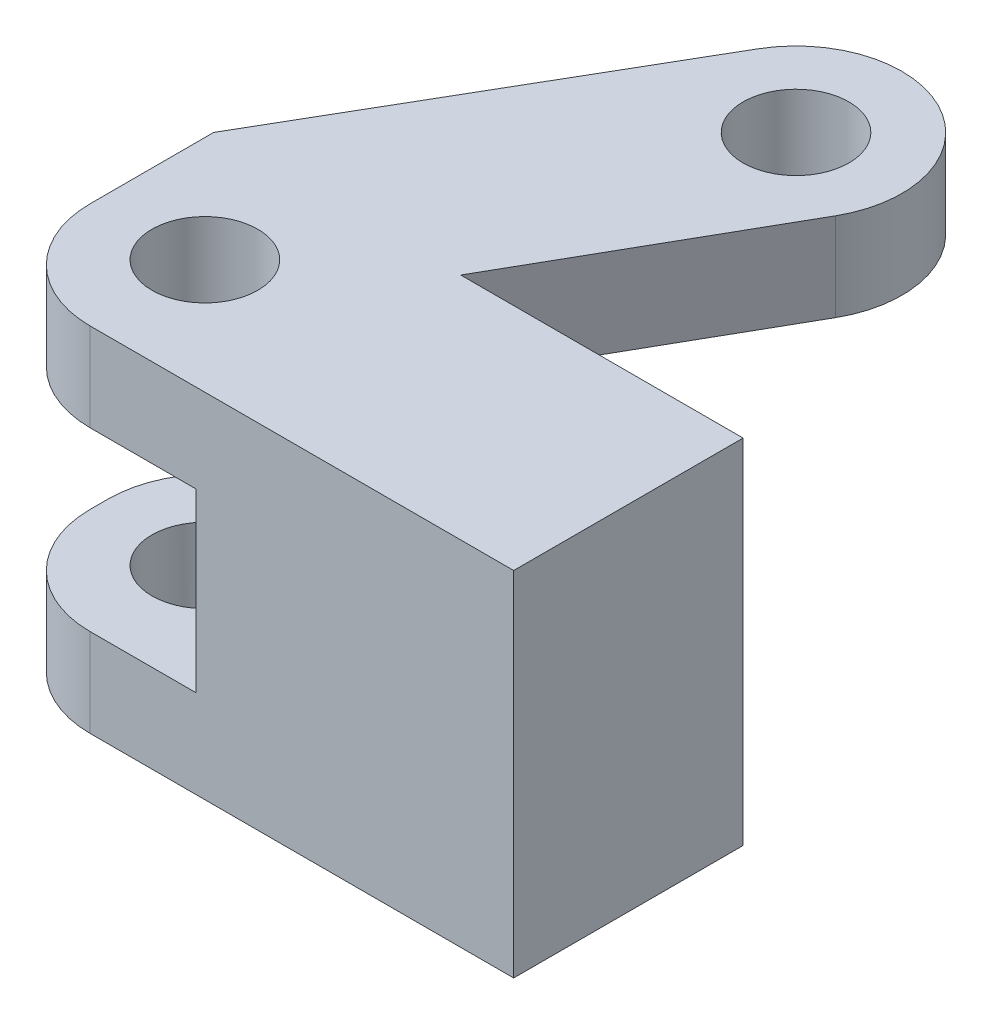
from build123d import *

# Parameters (mm, degrees)
SKETCH_1_W          = 30
SKETCH_1_H          = 13
EXTRUDE_1_DEPTH     = 10
SKETCH_2_W          = 24
SKETCH_2_H          = 10
CUT_EXTRUDE_1_DEPTH = 20
SKETCH_3_R          = 3
EXTRUDE_2_DEPTH     = 5
SKETCH_4_R          = 3
CUT_EXTRUDE_2_DEPTH = 39.288379438
FILLET_1_R          = 6


with BuildPart() as part:
    # 草图1 → 凸台-拉伸1 (new, symmetric)
    with BuildSketch(Plane(origin=(0, 0, 0), x_dir=(1, 0, 0), z_dir=(0, 1, 0))):
        Rectangle(SKETCH_1_W, SKETCH_1_H)
    extrude(amount=EXTRUDE_1_DEPTH, both=True)

    # 草图2 → 切除-拉伸1 (cut)
    with BuildSketch(Plane(origin=(0, 0, -6.5), x_dir=(-1, 0, 0), z_dir=(0, 0, -1))):
        with Locations((15, 0)):
            Rectangle(SKETCH_2_W, SKETCH_2_H)
    extrude(amount=-CUT_EXTRUDE_1_DEPTH, mode=Mode.SUBTRACT)

    # 草图3 → 凸台-拉伸2 (add)
    with BuildSketch(Plane(origin=(0, 10, 0), x_dir=(1, 0, 0), z_dir=(0, 1, 0))):
        with BuildLine():
            Line((-3.690899012, 26.00908083), (-15, 6.5))
            Line((-15, 6.5), (-1, 6.5))
            Line((-1, 6.5), (6.712455076, 20.028415898))
            ThreePointArc((6.712455076, 20.028415898), (4.49035189, 28.201710831), (-3.690899012, 26.00908083))
        make_face()
        with Locations(Location((1.5, 23, 0), (0, 0, 270))):
            Circle(SKETCH_3_R, mode=Mode.SUBTRACT)
    extrude(amount=-EXTRUDE_2_DEPTH)

    # 草图4 → 切除-拉伸2 (cut, through all)
    with BuildSketch(Plane(origin=(0, 10, 0), x_dir=(1, 0, 0), z_dir=(0, 1, 0))):
        with Locations(Location((-9, 0, 0), (0, 0, 270))):
            Circle(SKETCH_4_R)
    extrude(amount=-CUT_EXTRUDE_2_DEPTH, mode=Mode.SUBTRACT)

    # 圆角1
    fillet_1_edges = [part.edges().sort_by_distance(p)[0] for p in [
        (-15, -7.5, 6.5),
        (-15, -7.5, -6.5),
        (-15, 7.5, 6.5),
    ]]
    fillet(fillet_1_edges, radius=FILLET_1_R)


solid = part.part
